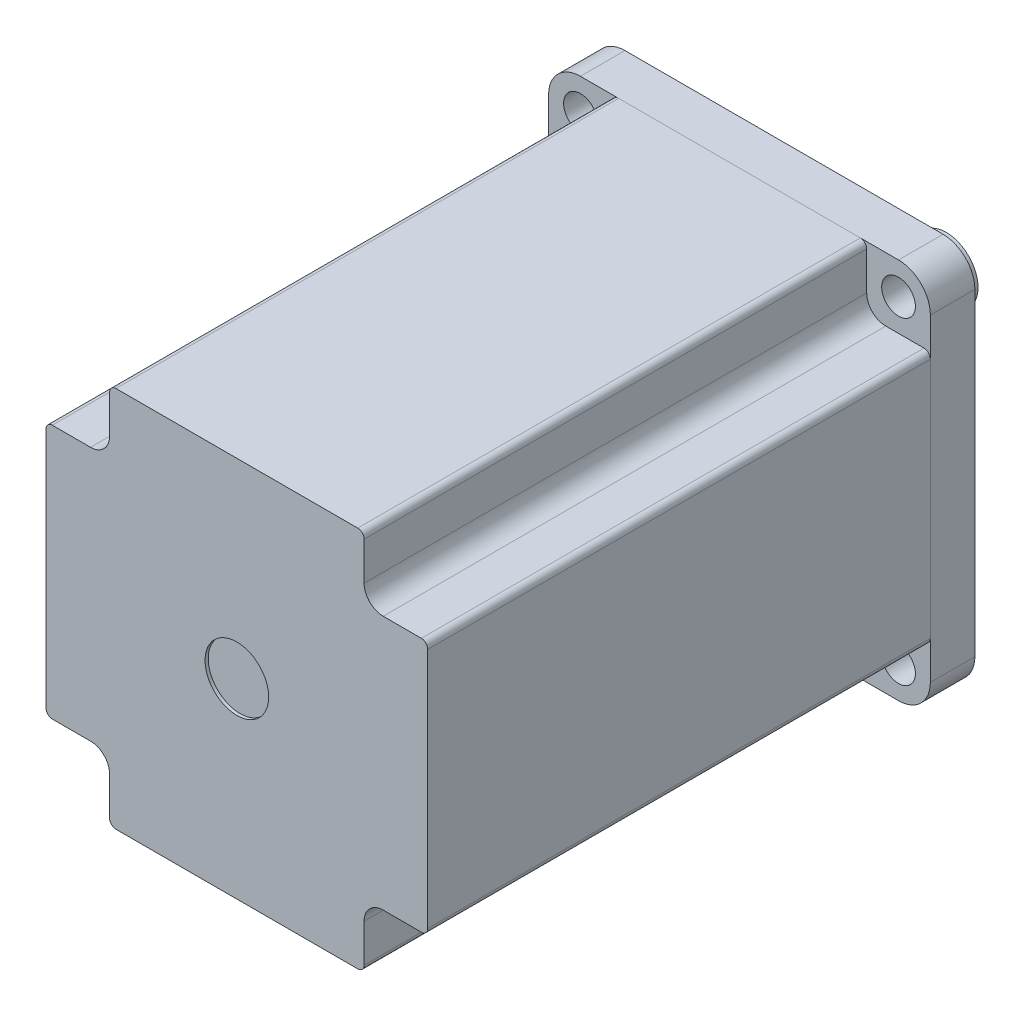
from build123d import *

# Parameters (mm, degrees)
SKETCH_1_W          = 60
SKETCH_1_H          = 60
EXTRUDE_1_DEPTH     = 7
FILLET_1_R          = 5
SKETCH_3_R          = 2.65
CUT_EXTRUDE_1_DEPTH = 86.141059425
SKETCH_4_W          = 60
SKETCH_4_H          = 60
EXTRUDE_2_DEPTH     = 79
SKETCH_5_W          = 10
SKETCH_5_H          = 10
CUT_EXTRUDE_2_DEPTH = 79
FILLET_2_R          = 3
FILLET_3_R          = 1
SKETCH_6_R          = 5
CUT_EXTRUDE_3_DEPTH = 0.5
SKETCH_7_R          = 18
EXTRUDE_3_DEPTH     = 1.5
SKETCH_8_R          = 5
EXTRUDE_4_DEPTH     = 24
SKETCH_9_W          = 10
SKETCH_9_H          = 8
EXTRUDE_5_DEPTH     = 2


with BuildPart() as part:
    # 草图1 → 凸台-拉伸1 (new body)
    with BuildSketch(Plane.XY):
        with Locations((30, 30)):
            Rectangle(SKETCH_1_W, SKETCH_1_H)
    extrude(amount=EXTRUDE_1_DEPTH)

    # 圆角1
    fillet_1_edges = [part.edges().sort_by_distance(p)[0] for p in [
        (0, 60, 3.5),
        (60, 60, 3.5),
        (60, 0, 3.5),
        (0, 0, 3.5),
    ]]
    fillet(fillet_1_edges, radius=FILLET_1_R)

    # 草图3 → 切除-拉伸1 (cut, through all)
    with BuildSketch(Plane(origin=(0, 0, 0), x_dir=(-1, 0, 0), z_dir=(0, 0, -1))):
        with Locations((-55, 55)):
            Circle(SKETCH_3_R)
        with Locations(Location((-5, 55, 0), (0, 0, 180))):
            Circle(SKETCH_3_R)
        with Locations((-5, 5)):
            Circle(SKETCH_3_R)
        with Locations(Location((-55, 5, 0), (0, 0, 180))):
            Circle(SKETCH_3_R)
    extrude(amount=-CUT_EXTRUDE_1_DEPTH, mode=Mode.SUBTRACT)

    # 草图7 → 凸台-拉伸3 (add)
    with BuildSketch(Plane(origin=(0, 0, 0), x_dir=(-1, 0, 0), z_dir=(0, 0, -1))):
        with Locations((-30, 30)):
            Circle(SKETCH_7_R)
    extrude(amount=EXTRUDE_3_DEPTH)

    # 草图8 → 凸台-拉伸4 (add)
    with BuildSketch(Plane(origin=(0, 0, -1.5), x_dir=(-1, 0, 0), z_dir=(0, 0, -1))):
        with Locations(Location((-30, 30, 0), (0, 0, 180))):
            Circle(SKETCH_8_R)
    extrude(amount=EXTRUDE_4_DEPTH)


with BuildPart() as body_2:
    # 草图4 → 凸台-拉伸2 (new body)
    with BuildSketch(Plane.XY.offset(7)):
        with Locations((30, 30)):
            Rectangle(SKETCH_4_W, SKETCH_4_H)
    extrude(amount=EXTRUDE_2_DEPTH)

    # 草图5 → 切除-拉伸2 (cut)
    with BuildSketch(Plane.XY.offset(86)):
        with Locations((5, 55)):
            Rectangle(SKETCH_5_W, SKETCH_5_H)
        with Locations((5, 5)):
            Rectangle(SKETCH_5_W, SKETCH_5_H)
        with Locations((55, 5)):
            Rectangle(SKETCH_5_W, SKETCH_5_H)
        with Locations((55, 55)):
            Rectangle(SKETCH_5_W, SKETCH_5_H)
    extrude(amount=-CUT_EXTRUDE_2_DEPTH, mode=Mode.SUBTRACT)

    # 圆角2
    fillet_2_edges = [body_2.edges().sort_by_distance(p)[0] for p in [
        (10, 50, 46.5),
        (10, 10, 46.5),
        (50, 10, 46.5),
        (50, 50, 46.5),
    ]]
    fillet(fillet_2_edges, radius=FILLET_2_R)

    # 圆角3
    fillet_3_edges = [body_2.edges().sort_by_distance(p)[0] for p in [
        (0, 50, 46.5),
        (10, 60, 46.5),
        (10, 0, 46.5),
        (0, 10, 46.5),
        (60, 10, 46.5),
        (50, 0, 46.5),
        (50, 60, 46.5),
        (60, 50, 46.5),
    ]]
    fillet(fillet_3_edges, radius=FILLET_3_R)

    # 草图6 → 切除-拉伸3 (cut)
    with BuildSketch(Plane.XY.offset(86)):
        with Locations((30, 30)):
            Circle(SKETCH_6_R)
    extrude(amount=-CUT_EXTRUDE_3_DEPTH, mode=Mode.SUBTRACT)

    # 草图9 → 凸台-拉伸5 (add)
    with BuildSketch(Plane.XZ):
        with Locations((30, 79)):
            Rectangle(SKETCH_9_W, SKETCH_9_H)
    extrude(amount=EXTRUDE_5_DEPTH)


solid = Compound([part.part, body_2.part])
